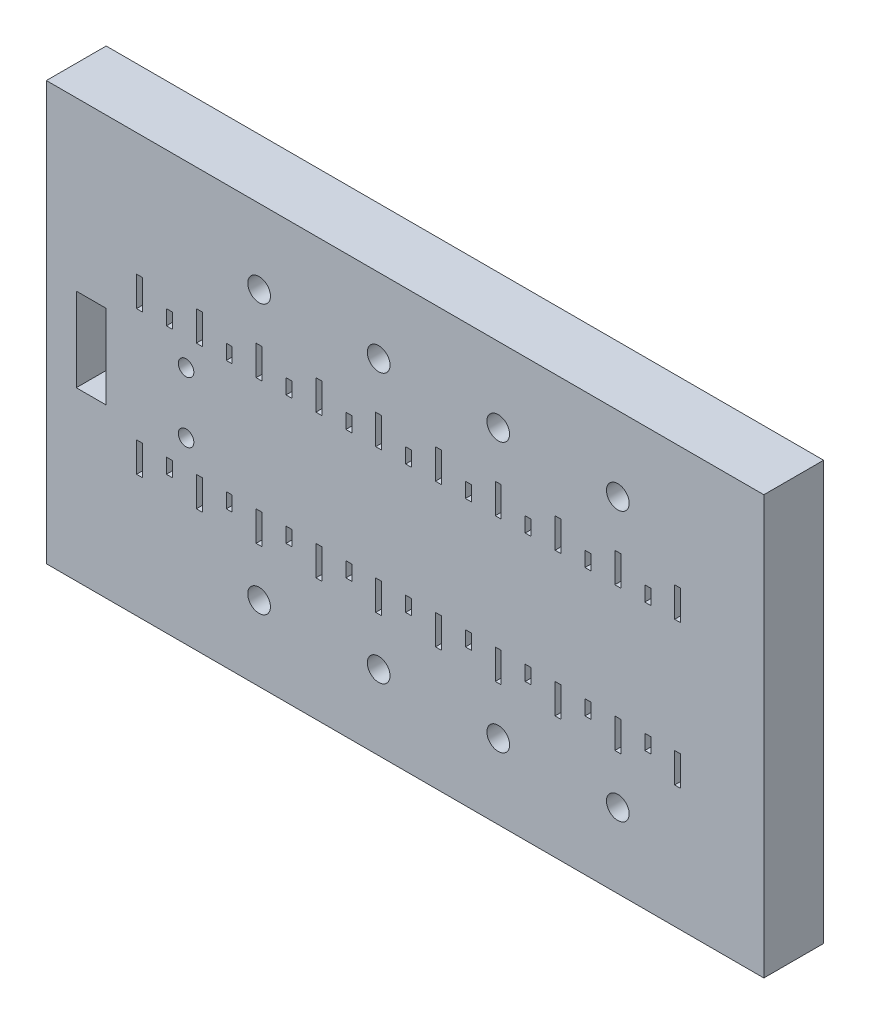
from build123d import *

# Parameters (mm, degrees)
SKETCH1_W           = 120
SKETCH1_H           = 70
BOSS_EXTRUDE1_DEPTH = 10
SKETCH2_W           = 5
SKETCH2_H           = 14
CUT_EXTRUDE1_DEPTH  = 71.178344238
SKETCH3_R           = 1.3
CUT_EXTRUDE2_DEPTH  = 71.178344238
SKETCH5_R           = 1.9
CUT_EXTRUDE3_DEPTH  = 71.178344238
CUT_EXTRUDE4_START  = -7
SKETCH7_R           = 1.9
CUT_EXTRUDE4_DEPTH  = 7
SKETCH4_W           = 1
SKETCH4_H           = 5
SKETCH4_H_2         = 2.5
CUT_EXTRUDE5_DEPTH  = 1


with BuildPart() as part:
    # Sketch1 → Boss-Extrude1 (new body)
    with BuildSketch(Plane.XY):
        Rectangle(SKETCH1_W, SKETCH1_H)
    extrude(amount=BOSS_EXTRUDE1_DEPTH)

    # Sketch2 → Cut-Extrude1 (cut, through all)
    with BuildSketch(Plane.XY.offset(10)):
        with Locations((-52.5, 0)):
            Rectangle(SKETCH2_W, SKETCH2_H)
    extrude(amount=-CUT_EXTRUDE1_DEPTH, mode=Mode.SUBTRACT)

    # Sketch3 → Cut-Extrude2 (cut, through all)
    with BuildSketch(Plane.XY.offset(10)):
        with Locations((-36.6358, 5.08)):
            Circle(SKETCH3_R)
        with Locations((-36.6358, -5.08)):
            Circle(SKETCH3_R)
    extrude(amount=-CUT_EXTRUDE2_DEPTH, mode=Mode.SUBTRACT)

    # Sketch5 → Cut-Extrude3 (cut, through all)
    with BuildSketch(Plane.XY.offset(10)):
        with Locations((-24.4209, -22.5)):
            Circle(SKETCH5_R)
        with Locations((-4.4209, -22.5)):
            Circle(SKETCH5_R)
        with Locations((15.5791, -22.5)):
            Circle(SKETCH5_R)
        with Locations((35.5791, -22.5)):
            Circle(SKETCH5_R)
        with Locations((35.5791, 22.5)):
            Circle(SKETCH5_R)
        with Locations(Location((15.5791, 22.5, 0), (0, 0, 180))):
            Circle(SKETCH5_R)
        with Locations(Location((-4.4209, 22.5, 0), (0, 0, 180))):
            Circle(SKETCH5_R)
        with Locations((-24.4209, 22.5)):
            Circle(SKETCH5_R)
    extrude(amount=-CUT_EXTRUDE3_DEPTH, mode=Mode.SUBTRACT)

    # Sketch7 → Cut-Extrude4 (cut)
    # profile 1 of 8: a face of its own
    with BuildSketch(Plane(origin=(0, 0, 0), x_dir=(-1, 0, 0), z_dir=(0, 0, -1)).offset(CUT_EXTRUDE4_START)):
        Polygon((26.788036104, -18.4), (22.053763896, -18.4), (19.686627793, -22.5), (22.053763896, -26.6), (26.788036104, -26.6), (29.155172207, -22.5), align=None)
        with Locations(Location((24.4209, -22.5, 0), (0, 0, 180))):
            Circle(SKETCH7_R, mode=Mode.SUBTRACT)
    # profile 2 of 8: a face of its own
    with BuildSketch(Plane(origin=(0, 0, 0), x_dir=(-1, 0, 0), z_dir=(0, 0, -1)).offset(CUT_EXTRUDE4_START)):
        Polygon((6.788036104, -26.6), (9.155172207, -22.5), (6.788036104, -18.4), (2.053763896, -18.4), (-0.313372207, -22.5), (2.053763896, -26.6), align=None)
        with Locations(Location((4.4209, -22.5, 0), (0, 0, 180))):
            Circle(SKETCH7_R, mode=Mode.SUBTRACT)
    # profile 3 of 8: a face of its own
    with BuildSketch(Plane(origin=(0, 0, 0), x_dir=(-1, 0, 0), z_dir=(0, 0, -1)).offset(CUT_EXTRUDE4_START)):
        Polygon((-13.211963896, -26.6), (-10.844827793, -22.5), (-13.211963896, -18.4), (-17.946236104, -18.4), (-20.313372207, -22.5), (-17.946236104, -26.6), align=None)
        with Locations(Location((-15.5791, -22.5, 0), (0, 0, 180))):
            Circle(SKETCH7_R, mode=Mode.SUBTRACT)
    # profile 4 of 8: a face of its own
    with BuildSketch(Plane(origin=(0, 0, 0), x_dir=(-1, 0, 0), z_dir=(0, 0, -1)).offset(CUT_EXTRUDE4_START)):
        Polygon((-33.211963896, -26.6), (-30.844827793, -22.5), (-33.211963896, -18.4), (-37.946236104, -18.4), (-40.313372207, -22.5), (-37.946236104, -26.6), align=None)
        with Locations(Location((-35.5791, -22.5, 0), (0, 0, 180))):
            Circle(SKETCH7_R, mode=Mode.SUBTRACT)
    # profile 5 of 8: a face of its own
    with BuildSketch(Plane(origin=(0, 0, 0), x_dir=(-1, 0, 0), z_dir=(0, 0, -1)).offset(CUT_EXTRUDE4_START)):
        Polygon((-33.211963896, 18.4), (-30.844827793, 22.5), (-33.211963896, 26.6), (-37.946236104, 26.6), (-40.313372207, 22.5), (-37.946236104, 18.4), align=None)
        with Locations(Location((-35.5791, 22.5, 0), (0, 0, 180))):
            Circle(SKETCH7_R, mode=Mode.SUBTRACT)
    # profile 6 of 8: a face of its own
    with BuildSketch(Plane(origin=(0, 0, 0), x_dir=(-1, 0, 0), z_dir=(0, 0, -1)).offset(CUT_EXTRUDE4_START)):
        Polygon((-13.211963896, 18.4), (-10.844827793, 22.5), (-13.211963896, 26.6), (-17.946236104, 26.6), (-20.313372207, 22.5), (-17.946236104, 18.4), align=None)
        with Locations((-15.5791, 22.5)):
            Circle(SKETCH7_R, mode=Mode.SUBTRACT)
    # profile 7 of 8: a face of its own
    with BuildSketch(Plane(origin=(0, 0, 0), x_dir=(-1, 0, 0), z_dir=(0, 0, -1)).offset(CUT_EXTRUDE4_START)):
        Polygon((6.788036104, 18.4), (9.155172207, 22.5), (6.788036104, 26.6), (2.053763896, 26.6), (-0.313372207, 22.5), (2.053763896, 18.4), align=None)
        with Locations((4.4209, 22.5)):
            Circle(SKETCH7_R, mode=Mode.SUBTRACT)
    # profile 8 of 8: a face of its own
    with BuildSketch(Plane(origin=(0, 0, 0), x_dir=(-1, 0, 0), z_dir=(0, 0, -1)).offset(CUT_EXTRUDE4_START)):
        Polygon((26.788036104, 18.4), (29.155172207, 22.5), (26.788036104, 26.6), (22.053763896, 26.6), (19.686627793, 22.5), (22.053763896, 18.4), align=None)
        with Locations(Location((24.4209, 22.5, 0), (0, 0, 180))):
            Circle(SKETCH7_R, mode=Mode.SUBTRACT)
    extrude(amount=CUT_EXTRUDE4_DEPTH, mode=Mode.SUBTRACT)

    # Sketch4 → Cut-Extrude5 (cut)
    with BuildSketch(Plane.XY.offset(10)):
        with Locations((-34.4209, -12)):
            Rectangle(SKETCH4_W, SKETCH4_H)
        with Locations((45.5791, -12)):
            Rectangle(SKETCH4_W, SKETCH4_H)
        with Locations((40.587322973, -10.75)):
            Rectangle(SKETCH4_W, SKETCH4_H_2)
        with Locations((35.5791, -12)):
            Rectangle(SKETCH4_W, SKETCH4_H)
        with Locations((30.587322973, -10.75)):
            Rectangle(SKETCH4_W, SKETCH4_H_2)
        with Locations((25.5791, -12)):
            Rectangle(SKETCH4_W, SKETCH4_H)
        with Locations((20.587322973, -10.75)):
            Rectangle(SKETCH4_W, SKETCH4_H_2)
        with Locations((15.5791, -12)):
            Rectangle(SKETCH4_W, SKETCH4_H)
        with Locations((10.587322973, -10.75)):
            Rectangle(SKETCH4_W, SKETCH4_H_2)
        with Locations((5.5791, -12)):
            Rectangle(SKETCH4_W, SKETCH4_H)
        with Locations((0.587322973, -10.75)):
            Rectangle(SKETCH4_W, SKETCH4_H_2)
        with Locations((-4.4209, -12)):
            Rectangle(SKETCH4_W, SKETCH4_H)
        with Locations((-9.412677027, -10.75)):
            Rectangle(SKETCH4_W, SKETCH4_H_2)
        with Locations((-14.4209, -12)):
            Rectangle(SKETCH4_W, SKETCH4_H)
        with Locations((-19.412677027, -10.75)):
            Rectangle(SKETCH4_W, SKETCH4_H_2)
        with Locations((-24.4209, -12)):
            Rectangle(SKETCH4_W, SKETCH4_H)
        with Locations((-29.412677027, -10.75)):
            Rectangle(SKETCH4_W, SKETCH4_H_2)
        with Locations((45.5791, 12)):
            Rectangle(SKETCH4_W, SKETCH4_H)
        with Locations((40.587322973, 10.75)):
            Rectangle(SKETCH4_W, SKETCH4_H_2)
        with Locations((35.5791, 12)):
            Rectangle(SKETCH4_W, SKETCH4_H)
        with Locations((30.587322973, 10.75)):
            Rectangle(SKETCH4_W, SKETCH4_H_2)
        with Locations((25.5791, 12)):
            Rectangle(SKETCH4_W, SKETCH4_H)
        with Locations((20.587322973, 10.75)):
            Rectangle(SKETCH4_W, SKETCH4_H_2)
        with Locations((15.5791, 12)):
            Rectangle(SKETCH4_W, SKETCH4_H)
        with Locations((10.587322973, 10.75)):
            Rectangle(SKETCH4_W, SKETCH4_H_2)
        with Locations((5.5791, 12)):
            Rectangle(SKETCH4_W, SKETCH4_H)
        with Locations((0.587322973, 10.75)):
            Rectangle(SKETCH4_W, SKETCH4_H_2)
        with Locations((-4.4209, 12)):
            Rectangle(SKETCH4_W, SKETCH4_H)
        with Locations((-9.412677027, 10.75)):
            Rectangle(SKETCH4_W, SKETCH4_H_2)
        with Locations((-14.4209, 12)):
            Rectangle(SKETCH4_W, SKETCH4_H)
        with Locations((-19.412677027, 10.75)):
            Rectangle(SKETCH4_W, SKETCH4_H_2)
        with Locations((-24.4209, 12)):
            Rectangle(SKETCH4_W, SKETCH4_H)
        with Locations((-29.412677027, 10.75)):
            Rectangle(SKETCH4_W, SKETCH4_H_2)
        Polygon((-34.4209, 9.5), (-33.9209, 9.5), (-33.9209, 14.5), (-34.9209, 14.5), (-34.9209, 9.5), align=None)
        with Locations((-44.4209, -12)):
            Rectangle(SKETCH4_W, SKETCH4_H)
        with Locations((-39.429122973, -10.75)):
            Rectangle(SKETCH4_W, SKETCH4_H_2)
        with Locations((-39.429122973, 10.75)):
            Rectangle(SKETCH4_W, SKETCH4_H_2)
        with Locations((-44.4209, 12)):
            Rectangle(SKETCH4_W, SKETCH4_H)
    extrude(amount=-CUT_EXTRUDE5_DEPTH, mode=Mode.SUBTRACT)


solid = part.part
